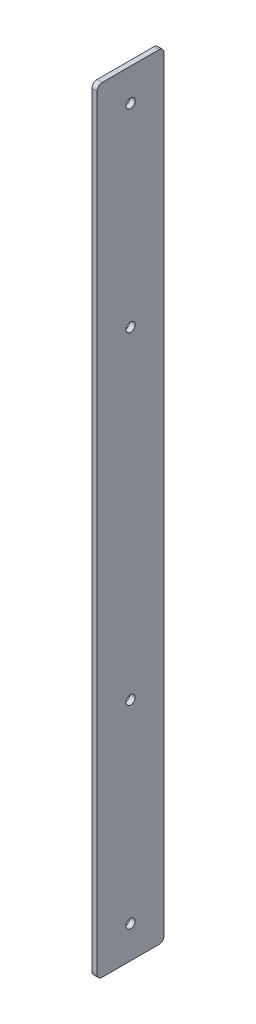
from build123d import *

# Parameters (mm, degrees)
SKETCH1_W           = 26
SKETCH1_H           = 300
BOSS_EXTRUDE1_DEPTH = 2
FILLET1_R           = 2
SKETCH2_R           = 1.75
CUT_EXTRUDE1_DEPTH  = 151.575562426


with BuildPart() as part:
    # Sketch1 → Boss-Extrude1 (new body)
    with BuildSketch(Plane(origin=(0, 0, 0), x_dir=(0, 0, -1), z_dir=(1, 0, 0))):
        Rectangle(SKETCH1_W, SKETCH1_H)
    extrude(amount=BOSS_EXTRUDE1_DEPTH)

    # Fillet1
    fillet1_edges = [part.edges().sort_by_distance(p)[0] for p in [
        (1, -150, -13),
        (1, -150, 13),
        (1, 150, 13),
        (1, 150, -13),
    ]]
    fillet(fillet1_edges, radius=FILLET1_R)

    # Sketch2 → Cut-Extrude1 (cut, through all)
    with BuildSketch(Plane(origin=(2, 0, 0), x_dir=(0, 0, -1), z_dir=(1, 0, 0))):
        with Locations((0, -137.5)):
            Circle(SKETCH2_R)
        with Locations((0, -62.5)):
            Circle(SKETCH2_R)
        with Locations((0, 62.5)):
            Circle(SKETCH2_R)
        with Locations((0, 137.5)):
            Circle(SKETCH2_R)
    extrude(amount=-CUT_EXTRUDE1_DEPTH, mode=Mode.SUBTRACT)


solid = part.part
